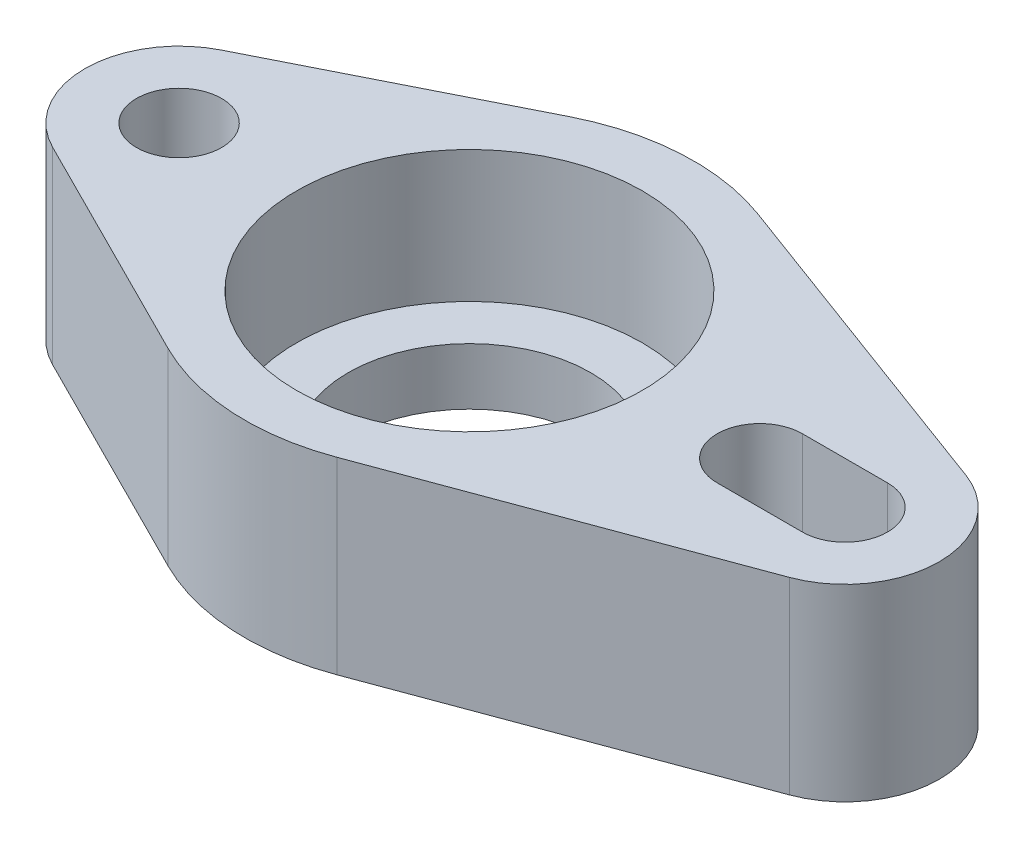
from build123d import *

# Parameters (mm, degrees)
BODY_DEPTH    = 7.3
SKETCH1_4_R   = 6.7
SKETCH1_4_R_2 = 4.7
FLOOR_2_DEPTH = 2.2


with BuildPart() as part:
    # Sketch1 → Body (new body)
    with BuildSketch(Plane(origin=(0, 0, 0), x_dir=(1, 0, 0), z_dir=(0, 1, 0))):
        with BuildLine():
            ThreePointArc((-9.081356282, 2.935895847), (-10.938876635, 3.636715861), (-12.888444444, 3.261594672))
            ThreePointArc((-12.888444444, 3.261594672), (-14.9, 0), (-12.888444444, -3.261594672))
            ThreePointArc((-12.888444444, -3.261594672), (-10.938876635, -3.636715861), (-9.081356282, -2.935895847))
            Line((-9.081356282, -2.935895847), (-11.990666667, -1.474419509))
            ThreePointArc((-11.990666667, -1.474419509), (-12.9, 0), (-11.990666667, 1.474419509))
            Line((-11.990666667, 1.474419509), (-9.081356282, 2.935895847))
        make_face()
        with BuildLine():
            ThreePointArc((-8.396888889, -2.276457113), (-8.551599574, -1.600045227), (-8.651913043, -0.913455362))
            Line((-8.651913043, -0.913455362), (-9.652022209, -0.411055931))
            ThreePointArc((-9.652022209, -0.411055931), (-10.567042376, -1.502021599), (-11.990666667, -1.474419509))
            Line((-11.990666667, -1.474419509), (-9.081356282, -2.935895847))
            ThreePointArc((-9.081356282, -2.935895847), (-8.717566338, -2.628550884), (-8.396888889, -2.276457113))
        make_face()
        with BuildLine():
            ThreePointArc((-8.396888889, 2.276457113), (-8.717566338, 2.628550884), (-9.081356282, 2.935895847))
            Line((-9.081356282, 2.935895847), (-11.990666667, 1.474419509))
            ThreePointArc((-11.990666667, 1.474419509), (-10.383859134, 1.404385987), (-9.6, 0))
            ThreePointArc((-9.6, 0), (-9.613057216, -0.207167377), (-9.652022209, -0.411055931))
            Line((-9.652022209, -0.411055931), (-8.651913043, -0.913455362))
            ThreePointArc((-8.651913043, -0.913455362), (-8.6723294, 0.69332732), (-8.396888889, 2.276457113))
        make_face()
        with BuildLine():
            ThreePointArc((-7.6, 0), (-7.804977826, 1.205952828), (-8.396888889, 2.276457113))
            ThreePointArc((-8.396888889, 2.276457113), (-8.6723294, 0.69332732), (-8.651913043, -0.913455362))
            Line((-8.651913043, -0.913455362), (-7.846323981, -1.318138671))
            ThreePointArc((-7.846323981, -1.318138671), (-7.662109431, -0.670478385), (-7.6, 0))
        make_face()
        with BuildLine():
            ThreePointArc((-8.396888889, -2.276457113), (-8.085124037, -1.818257446), (-7.846323981, -1.318138671))
            Line((-7.846323981, -1.318138671), (-8.651913043, -0.913455362))
            ThreePointArc((-8.651913043, -0.913455362), (-8.551599574, -1.600045227), (-8.396888889, -2.276457113))
        make_face()
        with BuildLine():
            Line((-12.888444444, -3.261594672), (-3.905333333, -7.774211957))
            ThreePointArc((-3.905333333, -7.774211957), (-6.309744397, -5.989751718), (-7.966765369, -3.495804564))
            Line((-7.966765369, -3.495804564), (-9.081356282, -2.935895847))
            ThreePointArc((-9.081356282, -2.935895847), (-10.938876635, -3.636715861), (-12.888444444, -3.261594672))
        make_face()
        with BuildLine():
            ThreePointArc((-7.966765369, 3.495804564), (-6.309744397, 5.989751718), (-3.905333333, 7.774211957))
            Line((-3.905333333, 7.774211957), (-12.888444444, 3.261594672))
            ThreePointArc((-12.888444444, 3.261594672), (-10.938876635, 3.636715861), (-9.081356282, 2.935895847))
            Line((-9.081356282, 2.935895847), (-7.966765369, 3.495804564))
        make_face()
        with BuildLine():
            ThreePointArc((-8.396888889, 2.276457113), (-8.204510785, 2.894132474), (-7.966765369, 3.495804564))
            Line((-7.966765369, 3.495804564), (-9.081356282, 2.935895847))
            ThreePointArc((-9.081356282, 2.935895847), (-8.717566338, 2.628550884), (-8.396888889, 2.276457113))
        make_face()
        with BuildLine():
            Line((-9.081356282, -2.935895847), (-7.966765369, -3.495804564))
            ThreePointArc((-7.966765369, -3.495804564), (-8.204510785, -2.894132474), (-8.396888889, -2.276457113))
            ThreePointArc((-8.396888889, -2.276457113), (-8.717566338, -2.628550884), (-9.081356282, -2.935895847))
        make_face()
        with BuildLine():
            ThreePointArc((-3.007555556, -5.987036795), (-5.087040274, -4.360277658), (-6.376599997, -2.056446565))
            Line((-6.376599997, -2.056446565), (-7.846323981, -1.318138671))
            ThreePointArc((-7.846323981, -1.318138671), (-8.085124037, -1.818257446), (-8.396888889, -2.276457113))
            ThreePointArc((-8.396888889, -2.276457113), (-8.204510785, -2.894132474), (-7.966765369, -3.495804564))
            Line((-7.966765369, -3.495804564), (-3.007555556, -5.987036795))
        make_face()
        with BuildLine():
            ThreePointArc((-6.376599997, -2.056446565), (-6.179805822, 2.588435821), (-3.007555556, 5.987036795))
            Line((-3.007555556, 5.987036795), (-7.966765369, 3.495804564))
            ThreePointArc((-7.966765369, 3.495804564), (-8.204510785, 2.894132474), (-8.396888889, 2.276457113))
            ThreePointArc((-8.396888889, 2.276457113), (-7.804977826, 1.205952828), (-7.6, 0))
            ThreePointArc((-7.6, 0), (-7.662109431, -0.670478385), (-7.846323981, -1.318138671))
            Line((-7.846323981, -1.318138671), (-6.376599997, -2.056446565))
        make_face()
        with BuildLine():
            Line((2.325429553, 6.283500409), (7.53020747, 4.357289922))
            ThreePointArc((7.53020747, 4.357289922), (5.606970779, 6.652208557), (3.019587629, 8.159172173))
            ThreePointArc((3.019587629, 8.159172173), (-0.482892281, 8.686588228), (-3.905333333, 7.774211957))
            ThreePointArc((-3.905333333, 7.774211957), (-6.309744397, 5.989751718), (-7.966765369, 3.495804564))
            Line((-7.966765369, 3.495804564), (-3.007555556, 5.987036795))
            ThreePointArc((-3.007555556, 5.987036795), (-0.371882561, 6.689671394), (2.325429553, 6.283500409))
        make_face()
        with BuildLine():
            Line((6.109376437, 2.750548955), (8.185210855, 1.982313673))
            ThreePointArc((8.185210855, 1.982313673), (8.287397099, 2.132014083), (8.396888889, 2.276457113))
            ThreePointArc((8.396888889, 2.276457113), (8.031224433, 3.345061151), (7.53020747, 4.357289922))
            Line((7.53020747, 4.357289922), (2.325429553, 6.283500409))
            ThreePointArc((2.325429553, 6.283500409), (4.57240905, 4.897251829), (6.109376437, 2.750548955))
        make_face()
        with BuildLine():
            ThreePointArc((8.396888889, -2.276457113), (7.604500307, -0.181195994), (8.185210855, 1.982313673))
            Line((8.185210855, 1.982313673), (6.109376437, 2.750548955))
            ThreePointArc((6.109376437, 2.750548955), (6.550680199, 1.406623239), (6.7, 0))
            ThreePointArc((6.7, 0), (5.498653381, -3.828160263), (2.325429553, -6.283500409))
            Line((2.325429553, -6.283500409), (7.53020747, -4.357289922))
            ThreePointArc((7.53020747, -4.357289922), (8.031224433, -3.345061151), (8.396888889, -2.276457113))
        make_face()
        with BuildLine():
            ThreePointArc((3.019587629, -8.159172173), (5.606970779, -6.652208557), (7.53020747, -4.357289922))
            Line((7.53020747, -4.357289922), (2.325429553, -6.283500409))
            ThreePointArc((2.325429553, -6.283500409), (-0.371882561, -6.689671394), (-3.007555556, -5.987036795))
            Line((-3.007555556, -5.987036795), (-7.966765369, -3.495804564))
            ThreePointArc((-7.966765369, -3.495804564), (-6.309744397, -5.989751718), (-3.905333333, -7.774211957))
            ThreePointArc((-3.905333333, -7.774211957), (-0.482892281, -8.686588228), (3.019587629, -8.159172173))
        make_face()
        with BuildLine():
            ThreePointArc((11.25, -3.65), (10.625334276, -3.596149709), (10.019100569, -3.436187799))
            Line((10.019100569, -3.436187799), (7.53020747, -4.357289922))
            ThreePointArc((7.53020747, -4.357289922), (5.606970779, -6.652208557), (3.019587629, -8.159172173))
            Line((3.019587629, -8.159172173), (15.816838488, -3.423100969))
            ThreePointArc((15.816838488, -3.423100969), (15.19349882, -3.592827476), (14.55, -3.65))
            Line((14.55, -3.65), (11.25, -3.65))
        make_face()
        with BuildLine():
            Line((7.53020747, -4.357289922), (10.019100569, -3.436187799))
            ThreePointArc((10.019100569, -3.436187799), (9.127259002, -2.969254226), (8.396888889, -2.276457113))
            ThreePointArc((8.396888889, -2.276457113), (8.031224433, -3.345061151), (7.53020747, -4.357289922))
        make_face()
        with BuildLine():
            ThreePointArc((8.7, 0), (8.649191008, 0.938879599), (8.497357494, 1.866792869))
            Line((8.497357494, 1.866792869), (8.185210855, 1.982313673))
            ThreePointArc((8.185210855, 1.982313673), (7.604500307, -0.181195994), (8.396888889, -2.276457113))
            ThreePointArc((8.396888889, -2.276457113), (8.6238893, -1.148274067), (8.7, 0))
        make_face()
        with BuildLine():
            Line((8.185210855, 1.982313673), (8.497357494, 1.866792869))
            ThreePointArc((8.497357494, 1.866792869), (8.449606287, 2.072233961), (8.396888889, 2.276457113))
            ThreePointArc((8.396888889, 2.276457113), (8.287397099, 2.132014083), (8.185210855, 1.982313673))
        make_face()
        with BuildLine():
            ThreePointArc((8.396888889, 2.276457113), (9.127259002, 2.969254226), (10.019100569, 3.436187799))
            Line((10.019100569, 3.436187799), (7.53020747, 4.357289922))
            ThreePointArc((7.53020747, 4.357289922), (8.031224433, 3.345061151), (8.396888889, 2.276457113))
        make_face()
        with BuildLine():
            ThreePointArc((10.170271524, 1.2476724), (10.673874779, 1.54614997), (11.25, 1.65))
            Line((11.25, 1.65), (14.55, 1.65))
            ThreePointArc((14.55, 1.65), (14.840896727, 1.624154886), (15.122680412, 1.547429205))
            Line((15.122680412, 1.547429205), (10.019100569, 3.436187799))
            ThreePointArc((10.019100569, 3.436187799), (9.127259002, 2.969254226), (8.396888889, 2.276457113))
            ThreePointArc((8.396888889, 2.276457113), (8.449606287, 2.072233961), (8.497357494, 1.866792869))
            Line((8.497357494, 1.866792869), (10.170271524, 1.2476724))
        make_face()
        with BuildLine():
            ThreePointArc((11.25, -1.65), (9.70385003, -0.576125221), (10.170271524, 1.2476724))
            Line((10.170271524, 1.2476724), (8.497357494, 1.866792869))
            ThreePointArc((8.497357494, 1.866792869), (8.649191008, 0.938879599), (8.7, 0))
            ThreePointArc((8.7, 0), (8.6238893, -1.148274067), (8.396888889, -2.276457113))
            ThreePointArc((8.396888889, -2.276457113), (9.127259002, -2.969254226), (10.019100569, -3.436187799))
            Line((10.019100569, -3.436187799), (15.122680412, -1.547429205))
            ThreePointArc((15.122680412, -1.547429205), (14.840896727, -1.624154886), (14.55, -1.65))
            Line((14.55, -1.65), (11.25, -1.65))
        make_face()
        with BuildLine():
            Line((10.019100569, 3.436187799), (15.122680412, 1.547429205))
            ThreePointArc((15.122680412, 1.547429205), (16.2, 0), (15.122680412, -1.547429205))
            Line((15.122680412, -1.547429205), (10.019100569, -3.436187799))
            ThreePointArc((10.019100569, -3.436187799), (10.625334276, -3.596149709), (11.25, -3.65))
            Line((11.25, -3.65), (14.55, -3.65))
            ThreePointArc((14.55, -3.65), (15.19349882, -3.592827476), (15.816838488, -3.423100969))
            ThreePointArc((15.816838488, -3.423100969), (18.2, 0), (15.816838488, 3.423100969))
            ThreePointArc((15.816838488, 3.423100969), (15.19349882, 3.592827476), (14.55, 3.65))
            Line((14.55, 3.65), (11.25, 3.65))
            ThreePointArc((11.25, 3.65), (10.625334276, 3.596149709), (10.019100569, 3.436187799))
        make_face()
        with BuildLine():
            Line((7.53020747, 4.357289922), (10.019100569, 3.436187799))
            ThreePointArc((10.019100569, 3.436187799), (10.625334276, 3.596149709), (11.25, 3.65))
            Line((11.25, 3.65), (14.55, 3.65))
            ThreePointArc((14.55, 3.65), (15.19349882, 3.592827476), (15.816838488, 3.423100969))
            Line((15.816838488, 3.423100969), (3.019587629, 8.159172173))
            ThreePointArc((3.019587629, 8.159172173), (5.606970779, 6.652208557), (7.53020747, 4.357289922))
        make_face()
    extrude(amount=BODY_DEPTH)

    # Sketch1<4> → Floor 2 (add)
    with BuildSketch(Plane(origin=(0, 0, 0), x_dir=(1, 0, 0), z_dir=(0, 1, 0))):
        with Locations(Location((0, 0, 0), (0, 0, 270))):
            Circle(SKETCH1_4_R)
        with Locations(Location((0, 0, 0), (0, 0, 270))):
            Circle(SKETCH1_4_R_2, mode=Mode.SUBTRACT)
    extrude(amount=FLOOR_2_DEPTH)


solid = part.part
